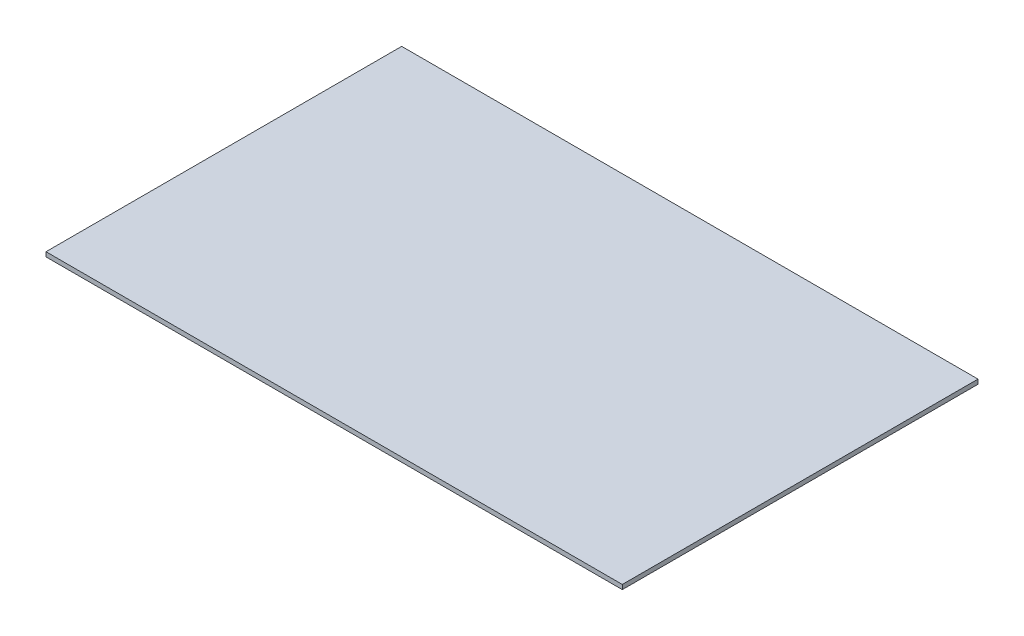
from build123d import *

# Parameters (mm, degrees)
ESQUISSE1_W        = 64
ESQUISSE1_H        = 79
BOSS_EXTRU_1_DEPTH = 1


with BuildPart() as part:
    # Esquisse1 → Boss.-Extru.1 (new body)
    with BuildSketch(Plane(origin=(0, 0, 0), x_dir=(1, 0, 0), z_dir=(0, 1, 0))):
        with Locations((32, 0)):
            Rectangle(ESQUISSE1_W, ESQUISSE1_H)
    boss_extru_1 = extrude(amount=BOSS_EXTRU_1_DEPTH)

    # Symétrie1: Boss.-Extru.1 across plane
    add(boss_extru_1.mirror(Plane(origin=(0, 1, -39.5), x_dir=(0, 0, 1), z_dir=(1, 0, 0))))


solid = part.part
